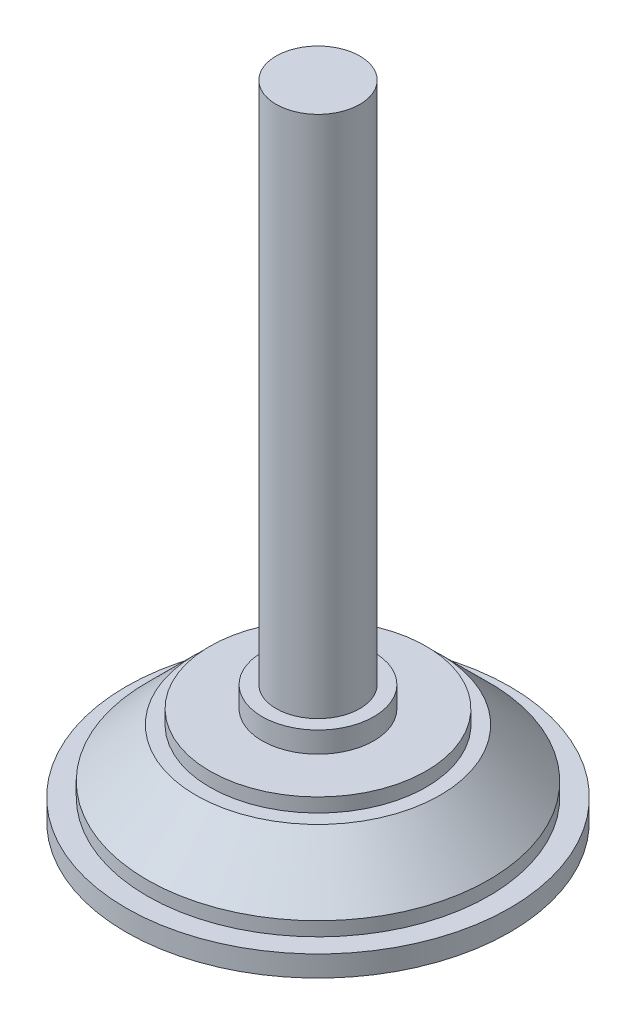
from build123d import *


with BuildPart() as part:
    # Esquisse1 → Révolution1 (revolve)
    with BuildSketch(Plane.XY, mode=Mode.PRIVATE) as r_volution1_sk:
        Polygon((0, 0), (27.5, 0), (27.5, 3), (24.5, 3), (24.5, 5), (17.5, 12), (15.5, 12), (15.5, 14), (8, 14), (8, 17), (6, 17), (6, 92), (0, 92), align=None)
    revolve(r_volution1_sk.sketch.rotate(Axis((0, 92, 0), (0, -1, 0)), 90), axis=Axis((0, 92, 0), (0, -1, 0)))


solid = part.part
